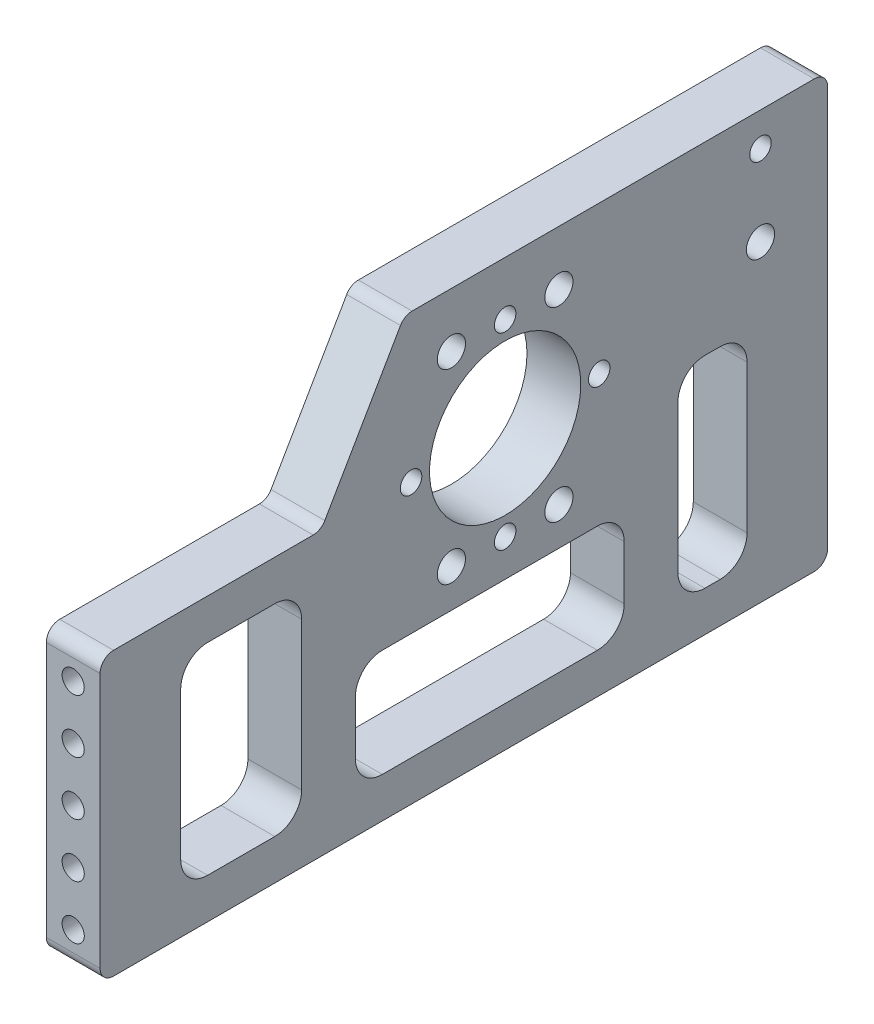
from build123d import *

# Parameters (mm, degrees)
SKETCH_1_R          = 1.6
SKETCH_1_R_2        = 11.25
SKETCH_1_R_3        = 2.1
EXTRUDE_1_DEPTH     = 8
SKETCH_2_R          = 1.65
CUT_EXTRUDE_1_DEPTH = 10
SKETCH_3_W          = 18
SKETCH_3_H          = 30
SKETCH_3_W_2        = 40
SKETCH_3_H_2        = 16
SKETCH_3_W_3        = 10.28
CUT_EXTRUDE_2_DEPTH = 10
FILLET_1_R          = 4
FILLET_2_R          = 2


with BuildPart() as part:
    # 草图1 → 凸台-拉伸1 (new body)
    with BuildSketch(Plane(origin=(0, 0, 0), x_dir=(0, 0, -1), z_dir=(1, 0, 0))):
        Polygon((0, 42), (0, 0), (108.28, 0), (108.28, 63.5), (45.28, 63.5), (32.866969212, 42), align=None)
        with Locations((46.28, 41.5)):
            Circle(SKETCH_1_R, mode=Mode.SUBTRACT)
        with Locations((60.28, 41.5)):
            Circle(SKETCH_1_R_2, mode=Mode.SUBTRACT)
        with Locations((74.28, 41.5)):
            Circle(SKETCH_1_R, mode=Mode.SUBTRACT)
        with Locations((52.28, 27.643593539)):
            Circle(SKETCH_1_R_3, mode=Mode.SUBTRACT)
        with Locations((60.28, 27.5)):
            Circle(SKETCH_1_R, mode=Mode.SUBTRACT)
        with Locations((68.28, 27.643593539)):
            Circle(SKETCH_1_R_3, mode=Mode.SUBTRACT)
        with Locations((98.28, 46.5)):
            Circle(SKETCH_1_R_3, mode=Mode.SUBTRACT)
        with Locations((60.28, 55.5)):
            Circle(SKETCH_1_R, mode=Mode.SUBTRACT)
        with Locations((68.28, 55.356406461)):
            Circle(SKETCH_1_R_3, mode=Mode.SUBTRACT)
        with Locations((98.28, 58.5)):
            Circle(SKETCH_1_R, mode=Mode.SUBTRACT)
        with Locations((52.28, 55.356406461)):
            Circle(SKETCH_1_R_3, mode=Mode.SUBTRACT)
    extrude(amount=EXTRUDE_1_DEPTH)

    # 草图2 → 切除-拉伸1 (cut)
    with BuildSketch(Plane.XY):
        with Locations((4, 21)):
            Circle(SKETCH_2_R)
        with Locations((4, 29)):
            Circle(SKETCH_2_R)
        with Locations((4, 37)):
            Circle(SKETCH_2_R)
        with Locations(Location((4, 5, 0), (0, 0, 180))):
            Circle(SKETCH_2_R)
        with Locations(Location((4, 13, 0), (0, 0, 180))):
            Circle(SKETCH_2_R)
    cut_extrude_1 = extrude(amount=-CUT_EXTRUDE_1_DEPTH, mode=Mode.SUBTRACT)

    # 镜向1: 切除-拉伸1 across plane
    add(cut_extrude_1.mirror(Plane.XY.offset(-54.14)), mode=Mode.SUBTRACT)

    # 草图3 → 切除-拉伸2 (cut)
    with BuildSketch(Plane(origin=(8, 0, 0), x_dir=(0, 0, -1), z_dir=(1, 0, 0))):
        with Locations((21, 21)):
            Rectangle(SKETCH_3_W, SKETCH_3_H)
        with Locations((58, 14)):
            Rectangle(SKETCH_3_W_2, SKETCH_3_H_2)
        with Locations((91.14, 21)):
            Rectangle(SKETCH_3_W_3, SKETCH_3_H)
    extrude(amount=-CUT_EXTRUDE_2_DEPTH, mode=Mode.SUBTRACT)

    # 圆角1
    fillet_1_edges = [part.edges().sort_by_distance(p)[0] for p in [
        (4, 6, -12),
        (4, 36, -12),
        (4, 36, -30),
        (4, 6, -30),
        (4, 6, -38),
        (4, 22, -38),
        (4, 22, -78),
        (4, 6, -78),
        (4, 6, -86),
        (4, 36, -86),
        (4, 36, -96.28),
        (4, 6, -96.28),
    ]]
    fillet(fillet_1_edges, radius=FILLET_1_R)

    # 圆角2
    fillet_2_edges = [part.edges().sort_by_distance(p)[0] for p in [
        (4, 0, -108.28),
        (4, 0, 0),
        (4, 42, 0),
        (4, 42, -32.866969212),
        (4, 63.5, -45.28),
        (4, 63.5, -108.28),
    ]]
    fillet(fillet_2_edges, radius=FILLET_2_R)


solid = part.part
